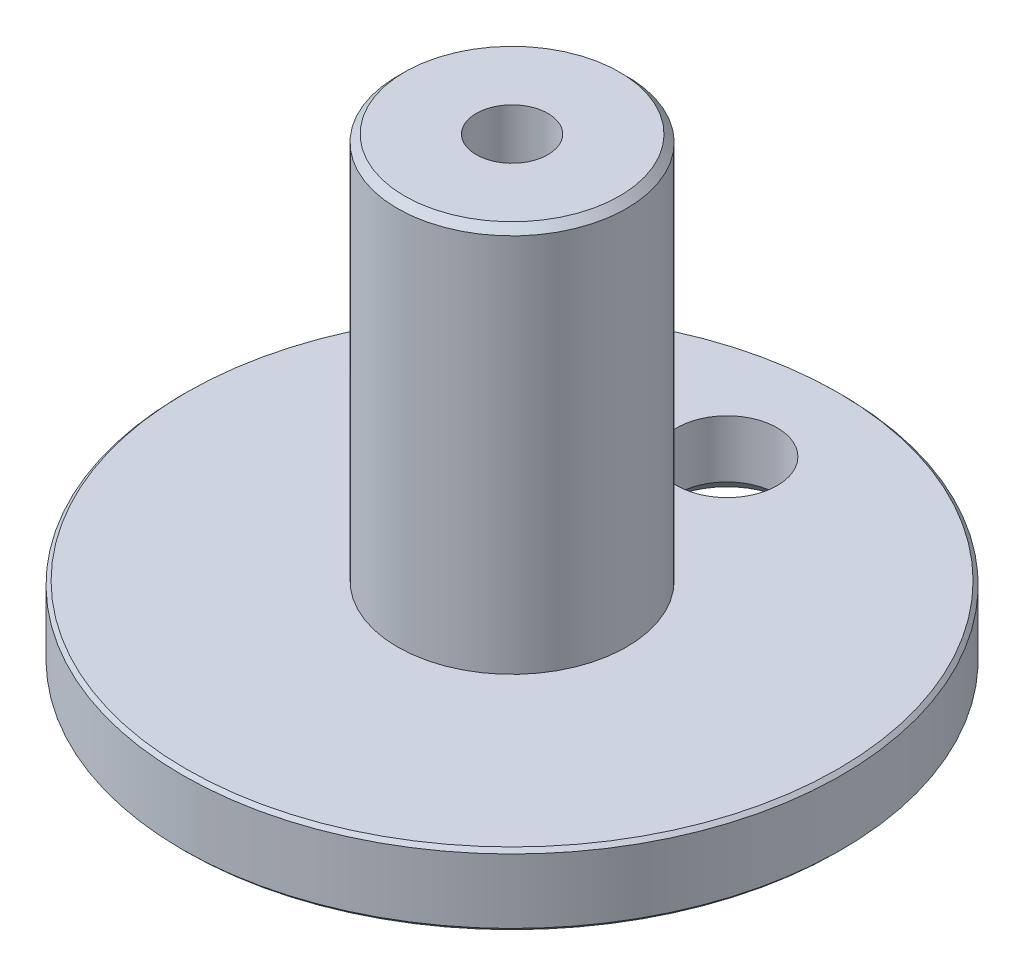
from build123d import *

# Parameters (mm, degrees)
SKETCH1_R           = 23
SKETCH1_R_2         = 3.5
SKETCH1_R_3         = 2.5
BOSS_EXTRUDE1_DEPTH = 5
SKETCH1_3_R         = 8
SKETCH1_3_R_2       = 2.5
BOSS_EXTRUDE2_DEPTH = 32
CHAMFER1_SIZE       = 0.5
CHAMFER2_SIZE       = 0.25
CHAMFER3_SIZE       = 1


with BuildPart() as part:
    # Sketch1 → Boss-Extrude1 (new body)
    with BuildSketch(Plane(origin=(0, 0, 0), x_dir=(1, 0, 0), z_dir=(0, 1, 0))):
        Circle(SKETCH1_R)
        with Locations((0, 15)):
            Circle(SKETCH1_R_2, mode=Mode.SUBTRACT)
        Circle(SKETCH1_R_3, mode=Mode.SUBTRACT)
    extrude(amount=BOSS_EXTRUDE1_DEPTH)

    # Sketch1<3> → Boss-Extrude2 (add)
    with BuildSketch(Plane(origin=(0, 0, 0), x_dir=(1, 0, 0), z_dir=(0, 1, 0))):
        Circle(SKETCH1_3_R)
        Circle(SKETCH1_3_R_2, mode=Mode.SUBTRACT)
    extrude(amount=BOSS_EXTRUDE2_DEPTH)

    # Chamfer1
    chamfer1_edges = [part.edges().sort_by_distance(p)[0] for p in [
        (-8, 32, 0),
    ]]
    chamfer(chamfer1_edges, length=CHAMFER1_SIZE)

    # Chamfer2
    chamfer2_edges = [part.edges().sort_by_distance(p)[0] for p in [
        (-23, 0, 0),
        (-23, 5, 0),
    ]]
    chamfer(chamfer2_edges, length=CHAMFER2_SIZE)

    # Chamfer3
    chamfer3_edges = [part.edges().sort_by_distance(p)[0] for p in [
        (-3.5, 0, -15),
    ]]
    chamfer(chamfer3_edges, length=CHAMFER3_SIZE)


solid = part.part
